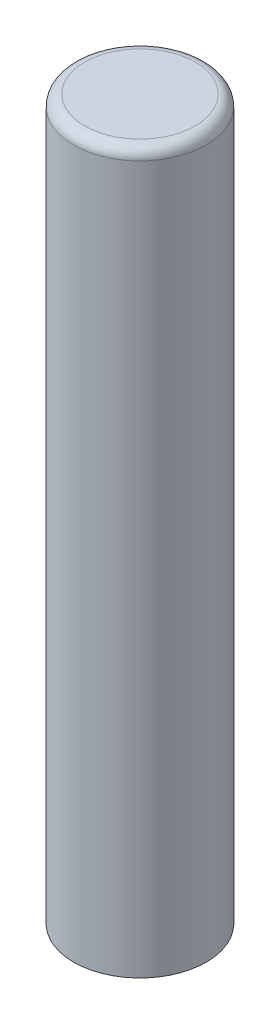
from build123d import *

# Parameters (mm, degrees)
SKETCH2_R           = 60
BOSS_EXTRUDE1_DEPTH = 650
FILLET1_R           = 10


with BuildPart() as part:
    # Sketch2 → Boss-Extrude1 (new body)
    with BuildSketch(Plane(origin=(0, 0, 0), x_dir=(1, 0, 0), z_dir=(0, 1, 0))):
        Circle(SKETCH2_R)
    extrude(amount=BOSS_EXTRUDE1_DEPTH)

    # Fillet1
    fillet1_edges = [part.edges().sort_by_distance(p)[0] for p in [
        (-60, 650, 0),
    ]]
    fillet(fillet1_edges, radius=FILLET1_R)


solid = part.part
